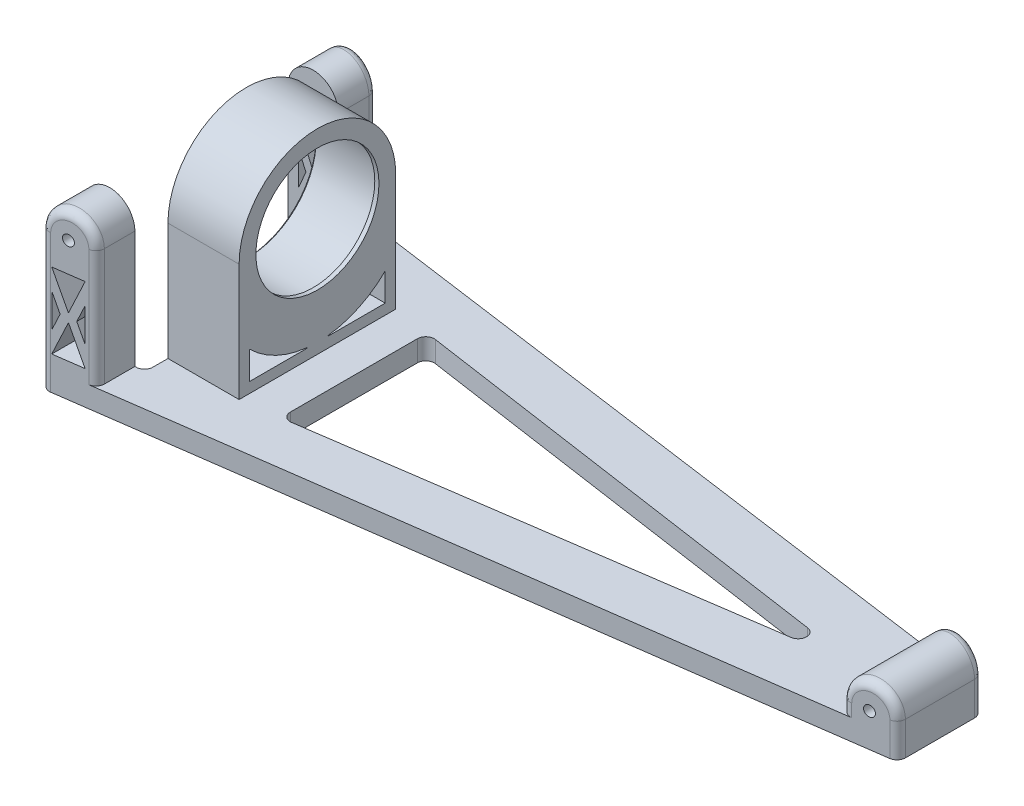
from build123d import *

# Parameters (mm, degrees)
BOSS_EXTRUDE1_DEPTH             = 5
BOSS_EXTRUDE2_REACH             = 185.439
SKETCH2_R                       = 1.25
BOSS_EXTRUDE2_DIRECTION_2_REACH = 185.439
CUT_EXTRUDE1_DEPTH              = 188.472664674
CUT_EXTRUDE1_DEPTH_BACK         = 188.472664674
SKETCH4_W                       = 14.3
SKETCH4_H                       = 48.6
SKETCH5_RX                      = 1.25
SKETCH5_RY                      = 0.173611111
SKETCH5_R                       = 16.2
BOSS_EXTRUDE3_DEPTH             = 16.5
SKETCH7_R                       = 16.2
SKETCH7_R_2                     = 14.7
BOSS_EXTRUDE5_DEPTH             = 0.5
CUT_EXTRUDE2_DEPTH              = 190.224443453
FILLET2_R                       = 2
FILLET5_R                       = 2
CHAMFER1_SIZE                   = 0.5
FILLET6_R                       = 2


with BuildPart() as part:
    # Sketch1 → Boss-Extrude1 (new body)
    with BuildSketch(Plane(origin=(0, 0, 0), x_dir=(1, 0, 0), z_dir=(0, 1, 0))):
        Polygon((0, -35), (0, 35), (180, 10), (180, -10), align=None)
    extrude(amount=BOSS_EXTRUDE1_DEPTH)

    # Boss-Extrude2: up to this plane
    boss_extrude2_end = Plane(origin=(4.769114307, 5, 34.337623013), z_dir=(-0.1375683712746877, 0, -0.9904922731777516))
    # Sketch2 → Boss-Extrude2 (add, up to the surface)
    with BuildSketch(Plane.XY, mode=Mode.PRIVATE) as boss_extrude2_sk1:
        with BuildLine():
            Line((0, 33), (0, 5))
            Line((0, 5), (12, 5))
            Line((12, 5), (12, 33))
            ThreePointArc((12, 33), (6, 39), (0, 33))
        make_face()
        Polygon((2.5, 8), (6, 16), (9.5, 8), align=None, mode=Mode.SUBTRACT)
        Polygon((2.5, 12.989785485), (2.5, 21.010214515), (4.25446885, 17), align=None, mode=Mode.SUBTRACT)
        Polygon((7.74553115, 17), (9.5, 21.010214515), (9.5, 12.989785485), align=None, mode=Mode.SUBTRACT)
        Polygon((6, 18), (2.5, 26), (9.5, 26), align=None, mode=Mode.SUBTRACT)
        with Locations((6, 33)):
            Circle(SKETCH2_R, mode=Mode.SUBTRACT)
    boss_extrude2_tool1 = split(extrude(boss_extrude2_sk1.sketch, amount=BOSS_EXTRUDE2_REACH, mode=Mode.PRIVATE), bisect_by=boss_extrude2_end, keep=Keep.BOTH, mode=Mode.PRIVATE)
    add(boss_extrude2_tool1.solids().sort_by_distance((11.639445, 19, 0))[0])
    # Sketch2 → Boss-Extrude2 (add, up to the surface)
    with BuildSketch(Plane.XY, mode=Mode.PRIVATE) as boss_extrude2_sk2:
        with BuildLine():
            Line((168, 8), (168, 5))
            Line((168, 5), (180, 5))
            Line((180, 5), (180, 8))
            ThreePointArc((180, 8), (174, 14), (168, 8))
        make_face()
        with Locations((174, 8)):
            Circle(SKETCH2_R, mode=Mode.SUBTRACT)
    boss_extrude2_tool2 = split(extrude(boss_extrude2_sk2.sketch, amount=BOSS_EXTRUDE2_REACH, mode=Mode.PRIVATE), bisect_by=boss_extrude2_end, keep=Keep.BOTH, mode=Mode.PRIVATE)
    add(boss_extrude2_tool2.solids().sort_by_distance((168.15, 6.5, 0))[0])

    # Boss-Extrude2 direction 2: up to this plane
    boss_extrude2_direction_2_end = Plane(origin=(4.769114307, 5, -34.337623013), z_dir=(-0.1375683712746877, 0, 0.9904922731777516))
    # Sketch2 → Boss-Extrude2 direction 2 (add, up to the surface)
    with BuildSketch(Plane.XY, mode=Mode.PRIVATE) as boss_extrude2_direction_2_sk1:
        with BuildLine():
            Line((0, 33), (0, 5))
            Line((0, 5), (12, 5))
            Line((12, 5), (12, 33))
            ThreePointArc((12, 33), (6, 39), (0, 33))
        make_face()
        Polygon((2.5, 8), (6, 16), (9.5, 8), align=None, mode=Mode.SUBTRACT)
        Polygon((2.5, 12.989785485), (2.5, 21.010214515), (4.25446885, 17), align=None, mode=Mode.SUBTRACT)
        Polygon((7.74553115, 17), (9.5, 21.010214515), (9.5, 12.989785485), align=None, mode=Mode.SUBTRACT)
        Polygon((6, 18), (2.5, 26), (9.5, 26), align=None, mode=Mode.SUBTRACT)
        with Locations((6, 33)):
            Circle(SKETCH2_R, mode=Mode.SUBTRACT)
    boss_extrude2_direction_2_tool1 = split(extrude(boss_extrude2_direction_2_sk1.sketch, amount=-BOSS_EXTRUDE2_DIRECTION_2_REACH, mode=Mode.PRIVATE), bisect_by=boss_extrude2_direction_2_end, keep=Keep.BOTH, mode=Mode.PRIVATE)
    add(boss_extrude2_direction_2_tool1.solids().sort_by_distance((11.639445, 19, 0))[0])
    # Sketch2 → Boss-Extrude2 direction 2 (add, up to the surface)
    with BuildSketch(Plane.XY, mode=Mode.PRIVATE) as boss_extrude2_direction_2_sk2:
        with BuildLine():
            Line((168, 8), (168, 5))
            Line((168, 5), (180, 5))
            Line((180, 5), (180, 8))
            ThreePointArc((180, 8), (174, 14), (168, 8))
        make_face()
        with Locations((174, 8)):
            Circle(SKETCH2_R, mode=Mode.SUBTRACT)
    boss_extrude2_direction_2_tool2 = split(extrude(boss_extrude2_direction_2_sk2.sketch, amount=-BOSS_EXTRUDE2_DIRECTION_2_REACH, mode=Mode.PRIVATE), bisect_by=boss_extrude2_direction_2_end, keep=Keep.BOTH, mode=Mode.PRIVATE)
    add(boss_extrude2_direction_2_tool2.solids().sort_by_distance((168.15, 6.5, 0))[0])

    # Sketch4 → Cut-Extrude1 (cut, two sides: drawn at the far end of the back side and taken through both)
    with BuildSketch(Plane(origin=(0, 0, 0), x_dir=(1, 0, 0), z_dir=(0, 1, 0)).offset(-CUT_EXTRUDE1_DEPTH_BACK)):
        with Locations((7.15, 0)):
            Rectangle(SKETCH4_W, SKETCH4_H)
    extrude(amount=CUT_EXTRUDE1_DEPTH + CUT_EXTRUDE1_DEPTH_BACK, mode=Mode.SUBTRACT)

    # Sketch5 → Boss-Extrude3 (add)
    # profile 1 of 2: a face of its own
    with BuildSketch(Plane.ZY.offset(-14.3)):
        with Locations(Location((-34.166666667, 33), (0, 0, 90))):
            Ellipse(SKETCH5_RX, SKETCH5_RY)
    # profile 2 of 2: a face of its own
    with BuildSketch(Plane.ZY.offset(-14.3)):
        with BuildLine():
            Line((-18.7, 5), (-18.7, 33))
            ThreePointArc((-18.7, 33), (0, 51.7), (18.7, 33))
            Line((18.7, 33), (18.7, 5))
            Line((18.7, 5), (-18.7, 5))
        make_face()
        with Locations((0, 33)):
            Circle(SKETCH5_R, mode=Mode.SUBTRACT)
        with BuildLine():
            Line((16.2, 7.5), (16.2, 14.173334694))
            ThreePointArc((16.2, 14.173334694), (9.90483685, 9.7420086), (2.5, 7.63627327))
            Line((2.5, 7.63627327), (2.5, 7.5))
            Line((2.5, 7.5), (16.2, 7.5))
        make_face(mode=Mode.SUBTRACT)
        with BuildLine():
            Line((-16.2, 7.5), (-16.2, 14.173334694))
            ThreePointArc((-16.2, 14.173334694), (-9.90483685, 9.7420086), (-2.5, 7.63627327))
            Line((-2.5, 7.63627327), (-2.5, 7.5))
            Line((-2.5, 7.5), (-16.2, 7.5))
        make_face(mode=Mode.SUBTRACT)
    extrude(amount=-BOSS_EXTRUDE3_DEPTH)


with BuildPart() as boss_extrude3_kept_piece:
    # of the separate pieces the step leaves, the one the design keeps (boss_extrude3_pieces_kept)
    add(part.part.solids().sort_by_distance((0, 0, 35))[0])

    # Sketch7 → Boss-Extrude5 (add, symmetric)
    # profile 1 of 2: a face of its own
    with BuildSketch(Plane(origin=(30.8, 0, 0), x_dir=(0, 0, -1), z_dir=(1, 0, 0))):
        with BuildLine():
            Line((18.7, 5), (18.7, 33))
            ThreePointArc((18.7, 33), (0, 51.7), (-18.7, 33))
            Line((-18.7, 33), (-18.7, 5))
            Line((-18.7, 5), (18.7, 5))
        make_face()
        with Locations(Location((0, 33, 0), (0, 0, 180))):
            Circle(SKETCH7_R, mode=Mode.SUBTRACT)
        with BuildLine():
            ThreePointArc((-16.2, 14.173334694), (-9.90483685, 9.7420086), (-2.5, 7.63627327))
            Line((-2.5, 7.63627327), (-2.5, 7.5))
            Line((-2.5, 7.5), (-16.2, 7.5))
            Line((-16.2, 7.5), (-16.2, 14.173334694))
        make_face(mode=Mode.SUBTRACT)
        with BuildLine():
            ThreePointArc((2.5, 7.63627327), (9.90483685, 9.7420086), (16.2, 14.173334694))
            Line((16.2, 14.173334694), (16.2, 7.5))
            Line((16.2, 7.5), (2.5, 7.5))
            Line((2.5, 7.5), (2.5, 7.63627327))
        make_face(mode=Mode.SUBTRACT)
    # profile 2 of 2: a face of its own
    with BuildSketch(Plane(origin=(30.8, 0, 0), x_dir=(0, 0, -1), z_dir=(1, 0, 0))):
        with Locations(Location((0, 33, 0), (0, 0, 180))):
            Circle(SKETCH7_R)
        with Locations((0, 33)):
            Circle(SKETCH7_R_2, mode=Mode.SUBTRACT)
    extrude(amount=BOSS_EXTRUDE5_DEPTH, both=True)

    # Sketch8 → Cut-Extrude2 (cut, through all)
    with BuildSketch(Plane(origin=(0, 5, 0), x_dir=(1, 0, 0), z_dir=(0, 1, 0))):
        Polygon((40, 17.5), (40, -17.5), (160, 0), align=None)
    extrude(amount=-CUT_EXTRUDE2_DEPTH, mode=Mode.SUBTRACT)

    # Fillet2
    fillet2_edges = [boss_extrude3_kept_piece.edges().sort_by_distance(p)[0] for p in [
        (40, 2.5, -17.5),
        (160, 2.5, 0),
        (40, 2.5, 17.5),
    ]]
    fillet(fillet2_edges, radius=FILLET2_R)

    # Fillet5
    fillet5_edges = [boss_extrude3_kept_piece.edges().sort_by_distance(p)[0] for p in [
        (14.3, 2.5, 24.3),
        (14.3, 2.5, -24.3),
    ]]
    fillet(fillet5_edges, radius=FILLET5_R)

    # Chamfer1
    chamfer1_edges = [boss_extrude3_kept_piece.edges().sort_by_distance(p)[0] for p in [
        (14.3, 33, -16.2),
    ]]
    chamfer(chamfer1_edges, length=CHAMFER1_SIZE)

    # Fillet6
    fillet6_edges = [boss_extrude3_kept_piece.edges().sort_by_distance(p)[0] for p in [
        (12, 19, 33.333333333),
        (6, 39, -34.166666667),
        (6, 39, 34.166666667),
        (12, 19, -33.333333333),
        (174, 14, -10.833333333),
        (168, 6.5, -11.666666667),
        (174, 14, 10.833333333),
        (168, 6.5, 11.666666667),
        (180, 4, 10),
        (0, 16.5, 35),
        (0, 16.5, -35),
        (180, 4, -10),
    ]]
    fillet(fillet6_edges, radius=FILLET6_R)


solid = boss_extrude3_kept_piece.part
